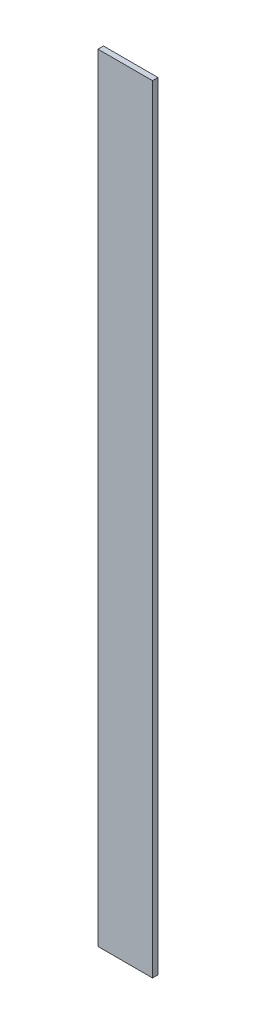
from build123d import *

# Parameters (mm, degrees)
SKETCH1_W           = 31.575
SKETCH1_H           = 450
BOSS_EXTRUDE1_DEPTH = 3.175


with BuildPart() as part:
    # Sketch1 → Boss-Extrude1 (new body)
    with BuildSketch(Plane.XY):
        with Locations((15.7875, 225)):
            Rectangle(SKETCH1_W, SKETCH1_H)
    extrude(amount=BOSS_EXTRUDE1_DEPTH)


solid = part.part
